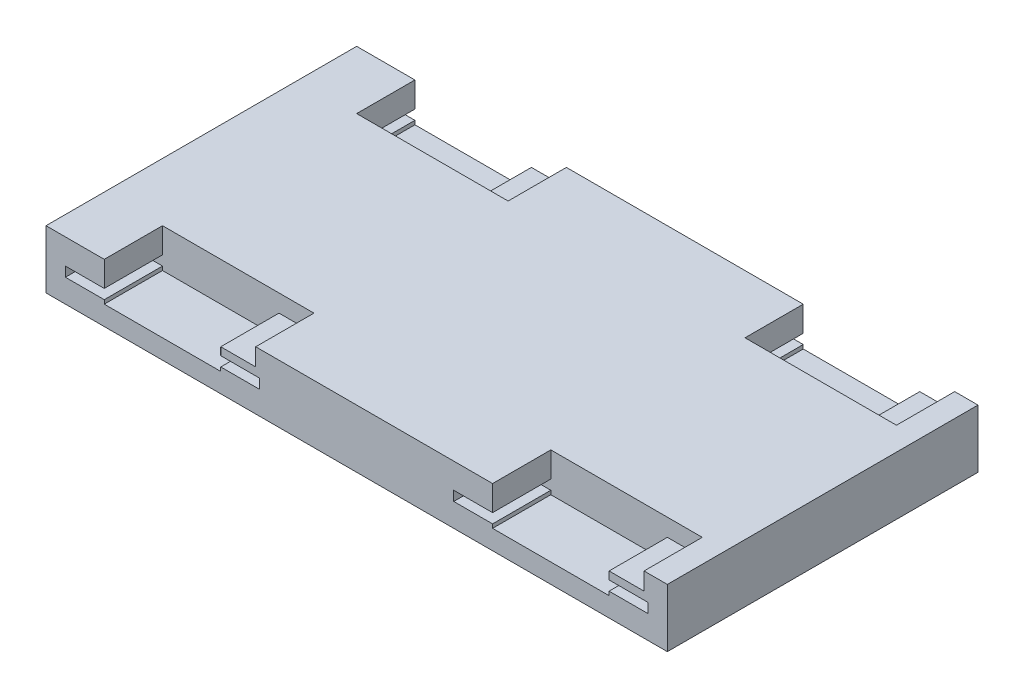
from build123d import *

# Parameters (mm, degrees)
SKETCH1_W               = 320
SKETCH1_H               = 160
BOSS_EXTRUDE1_DEPTH     = 20
SKETCH2_W               = 60
SKETCH2_H               = 30
CUT_EXTRUDE1_DEPTH      = 28
SKETCH3_W               = 20
SKETCH3_H               = 5
CUT_EXTRUDE3_DEPTH      = 30
MIRROR3_COPY_1_SKETCH_W = 60
MIRROR3_COPY_1_SKETCH_H = 30
MIRROR3_COPY_1_DEPTH    = 28
MIRROR3_COPY_2_SKETCH_W = 20
MIRROR3_COPY_2_SKETCH_H = 5
MIRROR3_COPY_2_DEPTH    = 30
SKETCH8_W               = 18
SKETCH8_H               = 9
CUT_EXTRUDE6_DEPTH      = 30
SKETCH9_W               = 18
SKETCH9_H               = 9
CUT_EXTRUDE7_DEPTH      = 30
SKETCH10_W              = 320
SKETCH10_H              = 160
BOSS_EXTRUDE2_DEPTH     = 10


with BuildPart() as part:
    # Sketch1 → Boss-Extrude1 (new body)
    with BuildSketch(Plane(origin=(0, 0, 0), x_dir=(1, 0, 0), z_dir=(0, 1, 0))):
        Rectangle(SKETCH1_W, SKETCH1_H)
    extrude(amount=BOSS_EXTRUDE1_DEPTH)

    # Sketch2 → Cut-Extrude1 (cut)
    with BuildSketch(Plane(origin=(0, 20, 0), x_dir=(1, 0, 0), z_dir=(0, 1, 0))):
        with Locations((-100, -65)):
            Rectangle(SKETCH2_W, SKETCH2_H)
    cut_extrude1 = extrude(amount=-CUT_EXTRUDE1_DEPTH, mode=Mode.SUBTRACT)

    # Sketch3 → Cut-Extrude3 (cut)
    with BuildSketch(Plane.XY.offset(80)):
        with Locations((-140, 4.5)):
            Rectangle(SKETCH3_W, SKETCH3_H)
        with Locations((-60, 4.5)):
            Rectangle(SKETCH3_W, SKETCH3_H)
    cut_extrude3 = extrude(amount=-CUT_EXTRUDE3_DEPTH, mode=Mode.SUBTRACT)

    # Mirror2: Cut-Extrude1, Cut-Extrude3 across plane
    add(cut_extrude1.mirror(Plane(origin=(0, 0, 0), x_dir=(0, 0, 1), z_dir=(1, 0, 0))), mode=Mode.SUBTRACT)
    add(cut_extrude3.mirror(Plane(origin=(0, 0, 0), x_dir=(0, 0, 1), z_dir=(1, 0, 0))), mode=Mode.SUBTRACT)

    # Mirror3: Cut-Extrude1, Cut-Extrude3 across plane
    add(cut_extrude1.mirror(Plane.XY), mode=Mode.SUBTRACT)
    add(cut_extrude3.mirror(Plane.XY), mode=Mode.SUBTRACT)

    # Mirror3 copy 1 sketch → Mirror3 copy 1 (cut)
    with BuildSketch(Plane(origin=(0, 20, 0), x_dir=(-1, 0, 0), z_dir=(0, 1, 0))):
        with Locations((-100, -65)):
            Rectangle(MIRROR3_COPY_1_SKETCH_W, MIRROR3_COPY_1_SKETCH_H)
    extrude(amount=-MIRROR3_COPY_1_DEPTH, mode=Mode.SUBTRACT)

    # Mirror3 copy 2 sketch → Mirror3 copy 2 (cut)
    with BuildSketch(Plane(origin=(0, 0, -80), x_dir=(-1, 0, 0), z_dir=(0, 0, -1))):
        with Locations((-140, 4.5)):
            Rectangle(MIRROR3_COPY_2_SKETCH_W, MIRROR3_COPY_2_SKETCH_H)
        with Locations((-60, 4.5)):
            Rectangle(MIRROR3_COPY_2_SKETCH_W, MIRROR3_COPY_2_SKETCH_H)
    extrude(amount=-MIRROR3_COPY_2_DEPTH, mode=Mode.SUBTRACT)

    # Sketch8 → Cut-Extrude6 (cut)
    with BuildSketch(Plane(origin=(0, 0, -80), x_dir=(-1, 0, 0), z_dir=(0, 0, -1))):
        with Locations((-139, 15.5)):
            Rectangle(SKETCH8_W, SKETCH8_H)
    cut_extrude6 = extrude(amount=-CUT_EXTRUDE6_DEPTH, mode=Mode.SUBTRACT)

    # Sketch9 → Cut-Extrude7 (cut)
    with BuildSketch(Plane(origin=(0, 0, -80), x_dir=(-1, 0, 0), z_dir=(0, 0, -1))):
        with Locations((61, 15.5)):
            Rectangle(SKETCH9_W, SKETCH9_H)
    cut_extrude7 = extrude(amount=-CUT_EXTRUDE7_DEPTH, mode=Mode.SUBTRACT)

    # Sketch10 → Boss-Extrude2 (add)
    with BuildSketch(Plane.XZ):
        Rectangle(SKETCH10_W, SKETCH10_H)
    extrude(amount=BOSS_EXTRUDE2_DEPTH)

    # Mirror4: Cut-Extrude6, Cut-Extrude7 across plane
    add(cut_extrude6.mirror(Plane.XY), mode=Mode.SUBTRACT)
    add(cut_extrude7.mirror(Plane.XY), mode=Mode.SUBTRACT)


solid = part.part
